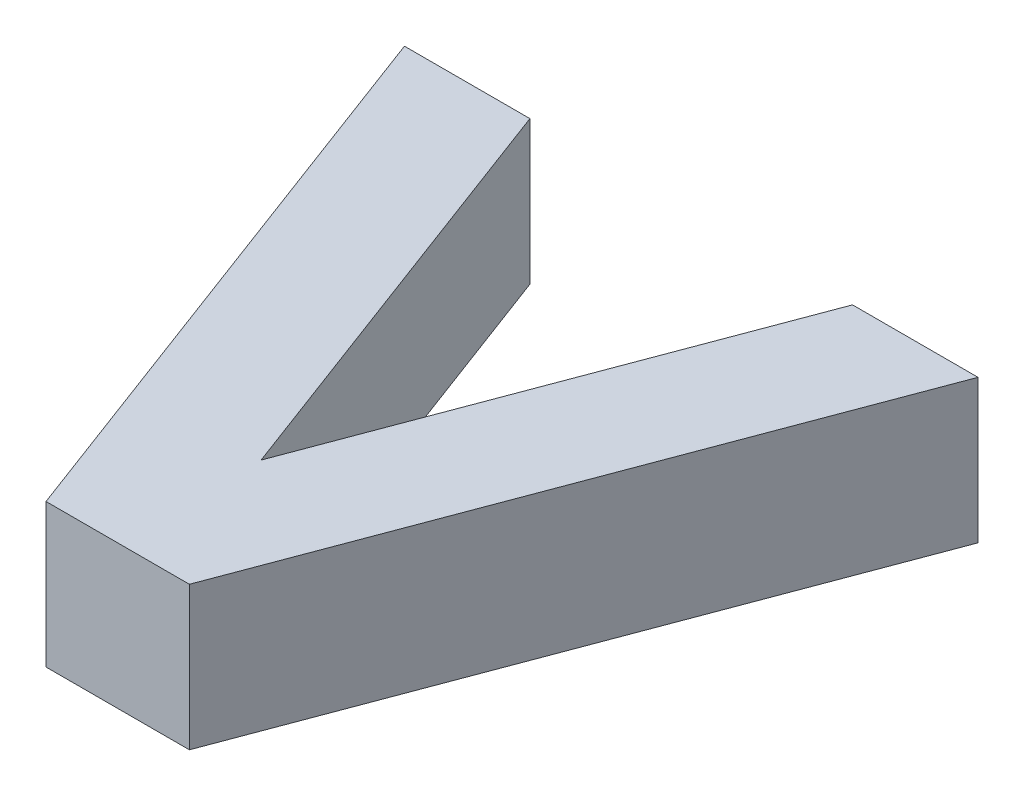
from build123d import *

# Parameters (mm, degrees)
BOSS_EXTRUDE1_DEPTH = 5


with BuildPart() as part:
    # Sketch1 → Boss-Extrude1 (new body)
    with BuildSketch(Plane(origin=(0, 0, 0), x_dir=(1, 0, 0), z_dir=(0, 1, 0))):
        Polygon((-2.5, 0), (2.5, 0), (10, 20), (5.625, 20), (0, 5), (-5.625, 20), (-10, 20), align=None)
    extrude(amount=BOSS_EXTRUDE1_DEPTH)


solid = part.part
